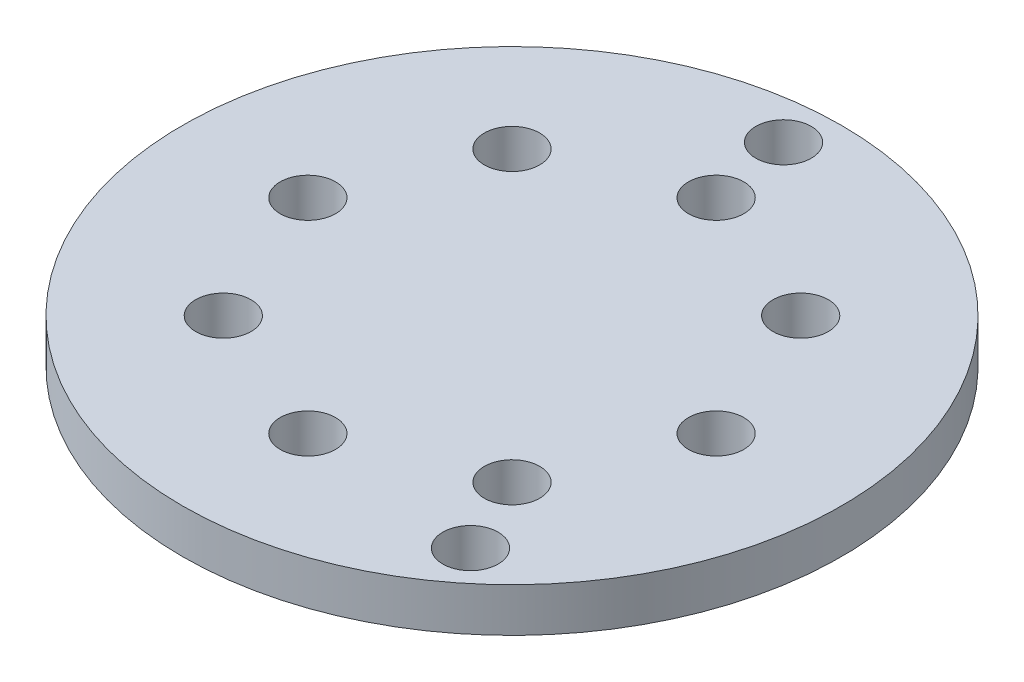
from build123d import *

# Parameters (mm, degrees)
SKETCH1_R           = 47.625
BOSS_EXTRUDE2_DEPTH = 6.35
SKETCH4_R           = 4
CUT_EXTRUDE1_DEPTH  = 68.650600515
CIRPATTERN2_COUNT   = 8
SKETCH5_R           = 4
CUT_EXTRUDE2_DEPTH  = 68.650600515
SKETCH6_R           = 4
CUT_EXTRUDE4_DEPTH  = 68.650600515


with BuildPart() as part:
    # Sketch1 → Boss-Extrude2 (new body)
    with BuildSketch(Plane(origin=(0, 0, 0), x_dir=(1, 0, 0), z_dir=(0, 1, 0))):
        Circle(SKETCH1_R)
    extrude(amount=BOSS_EXTRUDE2_DEPTH)

    # Sketch4 → Cut-Extrude1 (cut, through all)
    with BuildSketch(Plane(origin=(0, 6.35, 0), x_dir=(1, 0, 0), z_dir=(0, 1, 0))):
        with Locations((-29.5, 0)):
            Circle(SKETCH4_R)
    cut_extrude1 = extrude(amount=-CUT_EXTRUDE1_DEPTH, mode=Mode.SUBTRACT)

    # CirPattern2: Cut-Extrude1 ×8 about axis
    cirpattern2_axis = Axis((0, 6.35, 0), (0, 1, 0))
    for i in range(1, CIRPATTERN2_COUNT):
        add(cut_extrude1.rotate(cirpattern2_axis, i * 360 / CIRPATTERN2_COUNT), mode=Mode.SUBTRACT)

    # Sketch5 → Cut-Extrude2 (cut, through all)
    with BuildSketch(Plane(origin=(0, 6.35, 0), x_dir=(1, 0, 0), z_dir=(0, 1, 0))):
        with Locations((-2.072505689, 41.311946739)):
            Circle(SKETCH5_R)
    extrude(amount=-CUT_EXTRUDE2_DEPTH, mode=Mode.SUBTRACT)

    # Sketch6 → Cut-Extrude4 (cut, through all)
    with BuildSketch(Plane(origin=(0, 6.35, 0), x_dir=(1, 0, 0), z_dir=(0, 1, 0))):
        with Locations((26.094903113, -32.094053261)):
            Circle(SKETCH6_R)
    extrude(amount=-CUT_EXTRUDE4_DEPTH, mode=Mode.SUBTRACT)


solid = part.part
